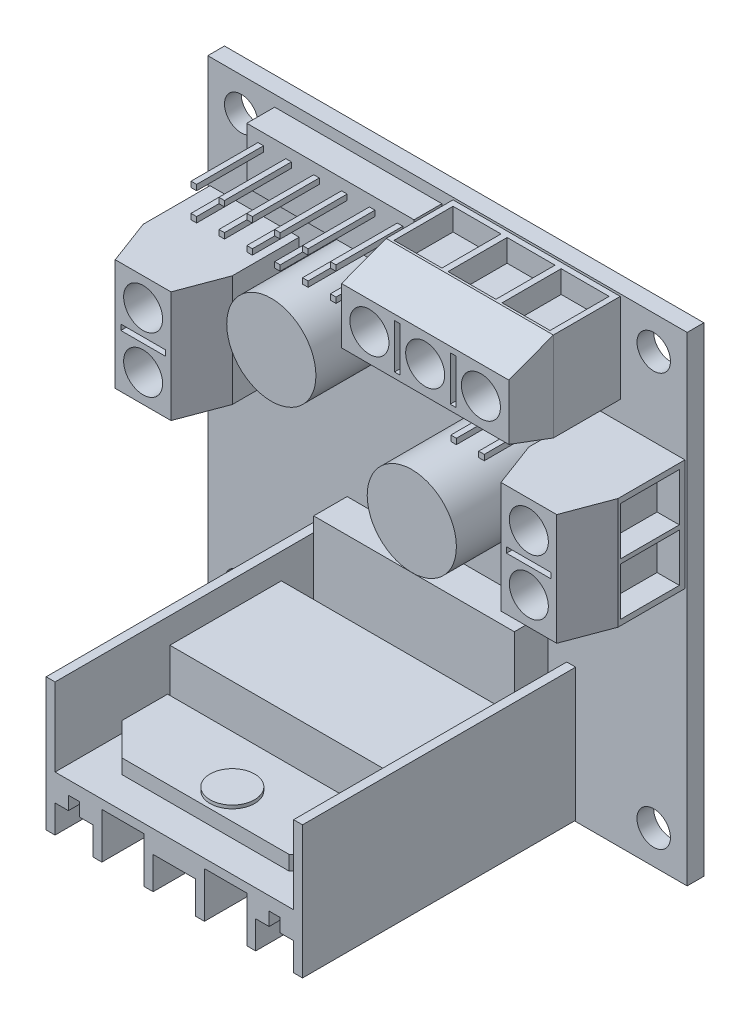
from build123d import *

# Parameters (mm, degrees)
SKETCH_1_W             = 43
SKETCH_1_H             = 43
SKETCH_1_R             = 1.5
EXTRUDE_1_DEPTH        = 1.5
EXTRUDE_2_DEPTH        = 24.5
SKETCH_3_W             = 20.8
SKETCH_3_H             = 10
EXTRUDE_3_DEPTH        = 5
EXTRUDE_4_DEPTH        = 1.3
SKETCH_5_R             = 2
EXTRUDE_5_DEPTH        = 0.3
SKETCH_6_W             = 18
SKETCH_6_H             = 3
EXTRUDE_6_DEPTH        = 10
SKETCH_7_W             = 8
SKETCH_7_H             = 10
SKETCH_7_W_2           = 15
SKETCH_7_H_2           = 8
EXTRUDE_7_DEPTH        = 6
EXTRUDE_8_DEPTH        = 10
EXTRUDE_9_DEPTH        = 10
EXTRUDE_10_DEPTH       = 15
SKETCH_11_R            = 1.75
SKETCH_11_W            = 4
SKETCH_11_H            = 0.5
SKETCH_11_W_2          = 0.5
SKETCH_11_H_2          = 4
CUT_EXTRUDE_1_DEPTH    = 4
SKETCH_12_W            = 5.3
SKETCH_12_H            = 4.3
CUT_EXTRUDE_2_DEPTH    = 2
SKETCH_13_W            = 4.3
SKETCH_13_H            = 5.3
CUT_EXTRUDE_3_DEPTH    = 2
SKETCH_14_W            = 5.3
SKETCH_14_H            = 4.3
CUT_EXTRUDE_4_DEPTH    = 2
SKETCH_15_R            = 4
EXTRUDE_11_DEPTH       = 9
SKETCH_16_W            = 15
SKETCH_16_H            = 5
SKETCH_16_W_2          = 5
SKETCH_16_H_2          = 1.6
EXTRUDE_12_DEPTH       = 2.5
SKETCH_17_W            = 0.5
SKETCH_17_H            = 0.5
EXTRUDE_13_DEPTH       = 6
SKETCH_18_W            = 0.5
SKETCH_18_H            = 0.5
EXTRUDE_14_DEPTH       = 6
PATTERN_LINEAR_1_COUNT = 6
PATTERN_LINEAR_1_PITCH = 2.5
SKETCH_19_R            = 0.25
EXTRUDE_15_DEPTH       = 2.2
PATTERN_LINEAR_2_COUNT = 9
PATTERN_LINEAR_2_PITCH = 2


with BuildPart() as part:
    # 草图1 → 凸台-拉伸1 (new body)
    with BuildSketch(Plane.XY):
        with Locations((21.5, 21.5)):
            Rectangle(SKETCH_1_W, SKETCH_1_H)
        with Locations((3, 40)):
            Circle(SKETCH_1_R, mode=Mode.SUBTRACT)
        with Locations((40, 3)):
            Circle(SKETCH_1_R, mode=Mode.SUBTRACT)
        with Locations((40, 40)):
            Circle(SKETCH_1_R, mode=Mode.SUBTRACT)
        with Locations((3, 3)):
            Circle(SKETCH_1_R, mode=Mode.SUBTRACT)
    extrude(amount=EXTRUDE_1_DEPTH)

    # 草图2 → 凸台-拉伸2 (add)
    with BuildSketch(Plane.XY.offset(1.5)):
        Polygon((33, 0.1), (33, 12), (32.2, 12), (32.2, 5), (10.8, 5), (10.8, 12), (10, 12), (10, 0.1), (10.8, 0.1), (10.8, 2.6), (12, 2.6), (12, 3.8), (13, 3.8), (13, 2.6), (14.2, 2.6), (14.2, 0.1), (15, 0.1), (15, 4.2), (18.8, 4.2), (18.8, 0.1), (19.6, 0.1), (19.6, 3), (23.4, 3), (23.4, 0.1), (24.2, 0.1), (24.2, 4.2), (28, 4.2), (28, 0.1), (28.8, 0.1), (28.8, 2.6), (30, 2.6), (30, 3.8), (31, 3.8), (31, 2.6), (32.2, 2.6), (32.2, 0.1), align=None)
    extrude(amount=EXTRUDE_2_DEPTH)

    # 草图3 → 凸台-拉伸3 (add)
    with BuildSketch(Plane(origin=(0, 5, 0), x_dir=(1, 0, 0), z_dir=(0, 1, 0))):
        with Locations((21.5, -11)):
            Rectangle(SKETCH_3_W, SKETCH_3_H)
    extrude(amount=EXTRUDE_3_DEPTH)

    # 草图4 → 凸台-拉伸4 (add)
    with BuildSketch(Plane(origin=(0, 5, 0), x_dir=(1, 0, 0), z_dir=(0, 1, 0))):
        Polygon((31.9, -16.2), (11.1, -16.2), (11.1, -20.3), (14, -23.2), (29, -23.2), (31.9, -20.3), align=None)
    extrude(amount=EXTRUDE_4_DEPTH)

    # 草图5 → 凸台-拉伸5 (add)
    with BuildSketch(Plane(origin=(0, 6.3, 0), x_dir=(1, 0, 0), z_dir=(0, 1, 0))):
        with Locations(Location((21.5, -20.8, 0), (0, 0, 90))):
            Circle(SKETCH_5_R)
    extrude(amount=EXTRUDE_5_DEPTH)

    # 草图6 → 凸台-拉伸6 (add)
    with BuildSketch(Plane(origin=(0, 5, 0), x_dir=(1, 0, 0), z_dir=(0, 1, 0))):
        with Locations((21.5, -3)):
            Rectangle(SKETCH_6_W, SKETCH_6_H)
    extrude(amount=EXTRUDE_6_DEPTH)

    # 草图7 → 凸台-拉伸7 (add)
    with BuildSketch(Plane.XY.offset(1.5)):
        with Locations((4.2, 28)):
            Rectangle(SKETCH_7_W, SKETCH_7_H)
        with Locations((38.8, 28)):
            Rectangle(SKETCH_7_W, SKETCH_7_H)
        with Locations((29.5, 38.8)):
            Rectangle(SKETCH_7_W_2, SKETCH_7_H_2)
    extrude(amount=EXTRUDE_7_DEPTH)

    # 草图8 → 凸台-拉伸8 (add)
    with BuildSketch(Plane(origin=(0, 33, 0), x_dir=(1, 0, 0), z_dir=(0, 1, 0))):
        Polygon((42.8, -7.5), (34.8, -7.5), (36.3, -11.5), (41.3, -11.5), align=None)
    extrude(amount=-EXTRUDE_8_DEPTH)

    # 草图9 → 凸台-拉伸9 (add)
    with BuildSketch(Plane(origin=(0, 33, 0), x_dir=(1, 0, 0), z_dir=(0, 1, 0))):
        Polygon((8.2, -7.5), (6.7, -11.5), (1.7, -11.5), (0.2, -7.5), align=None)
    extrude(amount=-EXTRUDE_9_DEPTH)


with BuildPart() as body_2:
    # 草图10 → 凸台-拉伸10 (new body)
    with BuildSketch(Plane(origin=(37, 0, 0), x_dir=(0, 0, -1), z_dir=(1, 0, 0))):
        Polygon((-7.5, 34.8), (-7.5, 42.8), (-11.5, 41.3), (-11.5, 36.3), align=None)
    extrude(amount=-EXTRUDE_10_DEPTH)


with BuildPart() as cut_extrude_1_tool:
    # 草图11 → 切除-拉伸1 (new body)
    with BuildSketch(Plane.XY.offset(11.5)):
        with Locations((38.8, 25.5)):
            Circle(SKETCH_11_R)
        with Locations((38.8, 30.5)):
            Circle(SKETCH_11_R)
        with Locations((4.2, 25.5)):
            Circle(SKETCH_11_R)
        with Locations((4.2, 30.5)):
            Circle(SKETCH_11_R)
        with Locations((34.5, 38.8)):
            Circle(SKETCH_11_R)
        with Locations((24.5, 38.8)):
            Circle(SKETCH_11_R)
        with Locations((29.5, 38.8)):
            Circle(SKETCH_11_R)
        with Locations((38.8, 28)):
            Rectangle(SKETCH_11_W, SKETCH_11_H)
        with Locations((4.2, 28)):
            Rectangle(SKETCH_11_W, SKETCH_11_H)
        with Locations((32, 38.8)):
            Rectangle(SKETCH_11_W_2, SKETCH_11_H_2)
        with Locations((27, 38.8)):
            Rectangle(SKETCH_11_W_2, SKETCH_11_H_2)
    extrude(amount=-CUT_EXTRUDE_1_DEPTH)


with BuildPart() as part_1:
    add(part.part)

    # 切除-拉伸1: cut by cut_extrude_1_tool
    add(cut_extrude_1_tool.part, mode=Mode.SUBTRACT)

    # 草图12 → 切除-拉伸2 (cut)
    with BuildSketch(Plane(origin=(42.8, 0, 0), x_dir=(0, 0, -1), z_dir=(1, 0, 0))):
        with Locations((-4.65, 25.65)):
            Rectangle(SKETCH_12_W, SKETCH_12_H)
        with Locations((-4.65, 30.35)):
            Rectangle(SKETCH_12_W, SKETCH_12_H)
    extrude(amount=-CUT_EXTRUDE_2_DEPTH, mode=Mode.SUBTRACT)

    # 草图13 → 切除-拉伸3 (cut)
    with BuildSketch(Plane(origin=(0, 42.8, 0), x_dir=(1, 0, 0), z_dir=(0, 1, 0))):
        with Locations((34.35, -4.65)):
            Rectangle(SKETCH_13_W, SKETCH_13_H)
        with Locations((29.5, -4.65)):
            Rectangle(SKETCH_13_W, SKETCH_13_H)
        with Locations((24.65, -4.65)):
            Rectangle(SKETCH_13_W, SKETCH_13_H)
    extrude(amount=-CUT_EXTRUDE_3_DEPTH, mode=Mode.SUBTRACT)

    # 草图14 → 切除-拉伸4 (cut)
    with BuildSketch(Plane.ZY.offset(-0.2)):
        with Locations((4.65, 30.35)):
            Rectangle(SKETCH_14_W, SKETCH_14_H)
        with Locations((4.65, 25.65)):
            Rectangle(SKETCH_14_W, SKETCH_14_H)
    extrude(amount=-CUT_EXTRUDE_4_DEPTH, mode=Mode.SUBTRACT)

    # 草图15 → 凸台-拉伸11 (add)
    with BuildSketch(Plane.XY.offset(1.5)):
        with Locations(Location((27.3, 25, 0), (0, 0, 180))):
            Circle(SKETCH_15_R)
        with Locations(Location((14.7, 32, 0), (0, 0, 180))):
            Circle(SKETCH_15_R)
    extrude(amount=EXTRUDE_11_DEPTH)

    # 草图16 → 凸台-拉伸12 (add)
    with BuildSketch(Plane.XY.offset(1.5)):
        with Locations((13.5, 39.5)):
            Rectangle(SKETCH_16_W, SKETCH_16_H)
        with Locations((31.8, 32.678003893)):
            Rectangle(SKETCH_16_W_2, SKETCH_16_H_2)
    extrude(amount=EXTRUDE_12_DEPTH)

    # 草图17 → 凸台-拉伸13 (add)
    with BuildSketch(Plane.XY.offset(4)):
        with Locations((33.05, 32.678003893)):
            Rectangle(SKETCH_17_W, SKETCH_17_H)
        with Locations((30.55, 32.678003893)):
            Rectangle(SKETCH_17_W, SKETCH_17_H)
    extrude(amount=EXTRUDE_13_DEPTH)

    # 草图18 → 凸台-拉伸14 (add)
    with BuildSketch(Plane.XY.offset(4)):
        with Locations((19.75, 38.25)):
            Rectangle(SKETCH_18_W, SKETCH_18_H)
        with Locations((19.75, 40.75)):
            Rectangle(SKETCH_18_W, SKETCH_18_H)
    extrude_14 = extrude(amount=EXTRUDE_14_DEPTH)

    # 阵列(线性)1: 凸台-拉伸14 ×6
    with Locations(*[(-i * PATTERN_LINEAR_1_PITCH, 0, 0) for i in range(1, PATTERN_LINEAR_1_COUNT)]):
        add(extrude_14)

    # 草图19 → 凸台-拉伸15 (add)
    with BuildSketch(Plane(origin=(0, 0, 0), x_dir=(-1, 0, 0), z_dir=(0, 0, -1))):
        with Locations((-13.883351716, 11.371916335)):
            Circle(SKETCH_19_R)
        with Locations((-13.883351716, 16.641813527)):
            Circle(SKETCH_19_R)
    extrude_15 = extrude(amount=EXTRUDE_15_DEPTH)

    # 阵列(线性)2: 凸台-拉伸15 ×9
    with Locations(*[(i * PATTERN_LINEAR_2_PITCH, 0, 0) for i in range(1, PATTERN_LINEAR_2_COUNT)]):
        add(extrude_15)


with BuildPart() as body_2_1:
    add(body_2.part)

    # 切除-拉伸1: cut by cut_extrude_1_tool
    add(cut_extrude_1_tool.part, mode=Mode.SUBTRACT)


solid = Compound([part_1.part, body_2_1.part])
